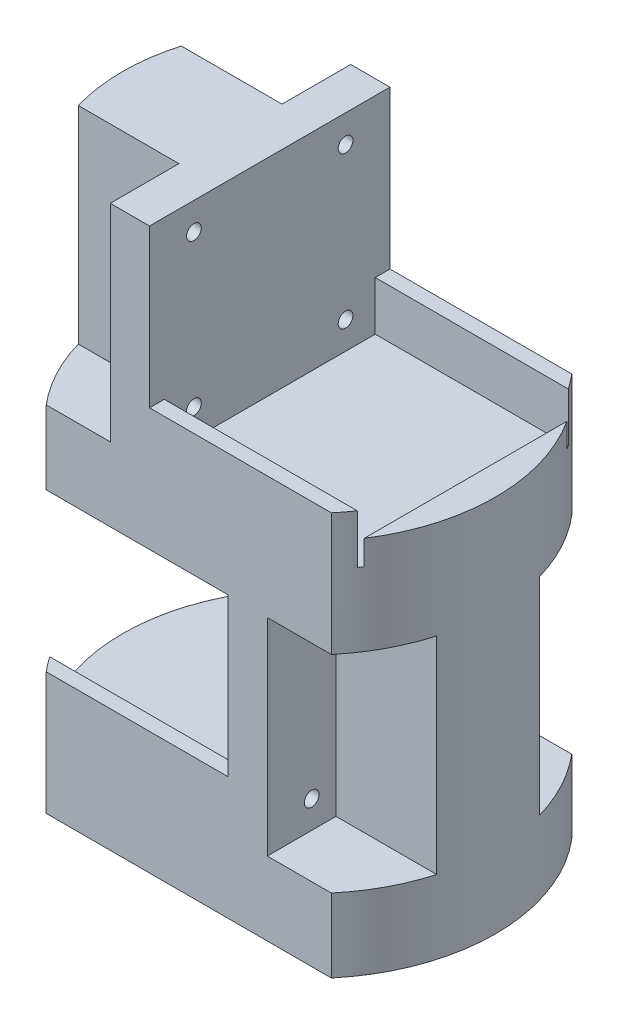
from build123d import *

# Parameters (mm, degrees)
SKETCH1_W           = 76
SKETCH1_H           = 43
BOSS_EXTRUDE1_DEPTH = 15
SKETCH3_W           = 30
SKETCH3_H           = 43
BOSS_EXTRUDE2_DEPTH = 42.1
BOSS_EXTRUDE3_START = 42.1
SKETCH4_W           = 76
SKETCH4_H           = 43
BOSS_EXTRUDE3_DEPTH = 15
SKETCH5_W           = 30
SKETCH5_H           = 43
BOSS_EXTRUDE4_DEPTH = 42.1
BOSS_EXTRUDE5_DEPTH = 3
BOSS_EXTRUDE6_DEPTH = 3
SKETCH2_OUTSIDE_W   = 107.134
SKETCH2_OUTSIDE_H   = 80.134
SKETCH2_OUTSIDE_R   = 38
CUT_EXTRUDE1_DEPTH  = 123.82463108
BOSS_EXTRUDE7_DEPTH = 5
CUT_EXTRUDE2_START  = 16
SKETCH9_W           = 14
SKETCH9_H           = 42.1
CUT_EXTRUDE2_DEPTH  = 40
CUT_EXTRUDE3_START  = -8
SKETCH10_W          = 14
SKETCH10_H          = 42.1
CUT_EXTRUDE3_DEPTH  = 40
SKETCH11_R          = 1.5
CUT_EXTRUDE4_DEPTH  = 60


with BuildPart() as part:
    # Sketch1 → Boss-Extrude1 (new body)
    with BuildSketch(Plane(origin=(0, 0, 0), x_dir=(1, 0, 0), z_dir=(0, 1, 0))):
        Rectangle(SKETCH1_W, SKETCH1_H)
    extrude(amount=BOSS_EXTRUDE1_DEPTH)

    # Sketch3 → Boss-Extrude2 (add)
    with BuildSketch(Plane(origin=(0, 15, 0), x_dir=(1, 0, 0), z_dir=(0, 1, 0))):
        with Locations((23, 0)):
            Rectangle(SKETCH3_W, SKETCH3_H)
    extrude(amount=BOSS_EXTRUDE2_DEPTH)

    # Sketch4 → Boss-Extrude3 (add)
    with BuildSketch(Plane(origin=(0, 15, 0), x_dir=(1, 0, 0), z_dir=(0, 1, 0)).offset(BOSS_EXTRUDE3_START)):
        Rectangle(SKETCH4_W, SKETCH4_H)
    extrude(amount=BOSS_EXTRUDE3_DEPTH)

    # Sketch5 → Boss-Extrude4 (add)
    with BuildSketch(Plane(origin=(0, 72.1, 0), x_dir=(1, 0, 0), z_dir=(0, 1, 0))):
        with Locations((-23, 0)):
            Rectangle(SKETCH5_W, SKETCH5_H)
    extrude(amount=BOSS_EXTRUDE4_DEPTH)

    # Sketch6 → Boss-Extrude5 (add)
    with BuildSketch(Plane.XY.offset(21.5)):
        Polygon((-38, 0), (38, 0), (38, 82.1), (-8, 82.1), (-8, 114.2), (-38, 114.2), (-38, 57.1), (8, 57.1), (8, 25), (-38, 25), align=None)
    extrude(amount=BOSS_EXTRUDE5_DEPTH)

    # Sketch7 → Boss-Extrude6 (add)
    with BuildSketch(Plane(origin=(0, 0, -21.5), x_dir=(-1, 0, 0), z_dir=(0, 0, -1))):
        Polygon((-38, 0), (38, 0), (38, 15), (38, 25), (-8, 25), (-8, 57.1), (38, 57.1), (38, 114.2), (8, 114.2), (8, 82.1), (-38, 82.1), (-38, 72.1), align=None)
    extrude(amount=BOSS_EXTRUDE6_DEPTH)

    # Sketch2 outside → Cut-Extrude1 (cut, through all)
    with BuildSketch(Plane(origin=(0, 0, 0), x_dir=(1, 0, 0), z_dir=(0, 1, 0))):
        Rectangle(SKETCH2_OUTSIDE_W, SKETCH2_OUTSIDE_H)
        Circle(SKETCH2_OUTSIDE_R, mode=Mode.SUBTRACT)
    extrude(amount=CUT_EXTRUDE1_DEPTH, mode=Mode.SUBTRACT)

    # Sketch8 → Boss-Extrude7 (add)
    with BuildSketch(Plane(origin=(0, 72.1, 0), x_dir=(1, 0, 0), z_dir=(0, 1, 0))):
        with BuildLine():
            Line((31.9, -20.64921306), (31.9, 20.64921306))
            ThreePointArc((31.9, 20.64921306), (38, 0), (31.9, -20.64921306))
        make_face()
    extrude(amount=BOSS_EXTRUDE7_DEPTH)

    # Sketch9 → Cut-Extrude2 (cut)
    with BuildSketch(Plane(origin=(0, 0, 0), x_dir=(0, 0, -1), z_dir=(1, 0, 0)).offset(CUT_EXTRUDE2_START)):
        with Locations((-17.5, 36.05)):
            Rectangle(SKETCH9_W, SKETCH9_H)
        with Locations((17.5, 36.05)):
            Rectangle(SKETCH9_W, SKETCH9_H)
    extrude(amount=CUT_EXTRUDE2_DEPTH, mode=Mode.SUBTRACT)

    # Sketch10 → Cut-Extrude3 (cut)
    with BuildSketch(Plane(origin=(-8, 0, 0), x_dir=(0, 0, -1), z_dir=(1, 0, 0)).offset(CUT_EXTRUDE3_START)):
        with Locations((-17.5, 93.15)):
            Rectangle(SKETCH10_W, SKETCH10_H)
        with Locations((17.5, 93.15)):
            Rectangle(SKETCH10_W, SKETCH10_H)
    extrude(amount=-CUT_EXTRUDE3_DEPTH, mode=Mode.SUBTRACT)

    # Sketch11 → Cut-Extrude4 (cut)
    with BuildSketch(Plane(origin=(16, 0, 0), x_dir=(0, 0, -1), z_dir=(1, 0, 0))):
        with Locations((-15.45, 20.6)):
            Circle(SKETCH11_R)
        with Locations((15.45, 20.6)):
            Circle(SKETCH11_R)
        with Locations((15.45, 51.5)):
            Circle(SKETCH11_R)
        with Locations((-15.45, 51.5)):
            Circle(SKETCH11_R)
    cut_extrude4 = extrude(amount=-CUT_EXTRUDE4_DEPTH, mode=Mode.SUBTRACT)

    # Mirror1: Cut-Extrude4 across plane
    add(cut_extrude4.mirror(Plane.ZX.offset(64.6)), mode=Mode.SUBTRACT)


solid = part.part
